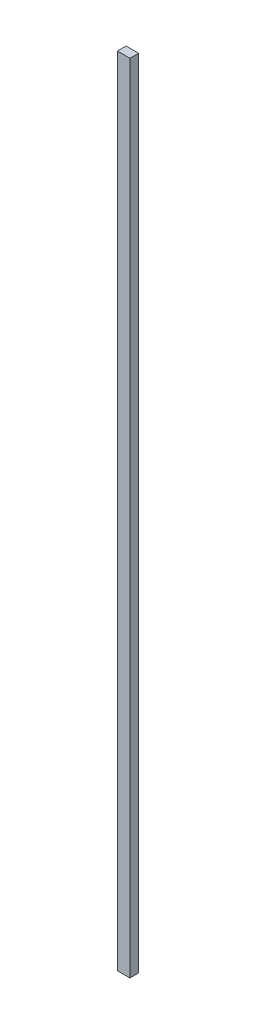
from build123d import *

# Parameters (mm, degrees)
SKETCH1_W           = 1.416679196
SKETCH1_H           = 0.976863472
BOSS_EXTRUDE1_DEPTH = 89.916


with BuildPart() as part:
    # Sketch1 → Boss-Extrude1 (new body)
    with BuildSketch(Plane(origin=(0, 0, 0), x_dir=(1, 0, 0), z_dir=(0, 1, 0))):
        with Locations((-14.496737819, 13.108416339)):
            Rectangle(SKETCH1_W, SKETCH1_H)
    extrude(amount=BOSS_EXTRUDE1_DEPTH)


solid = part.part
